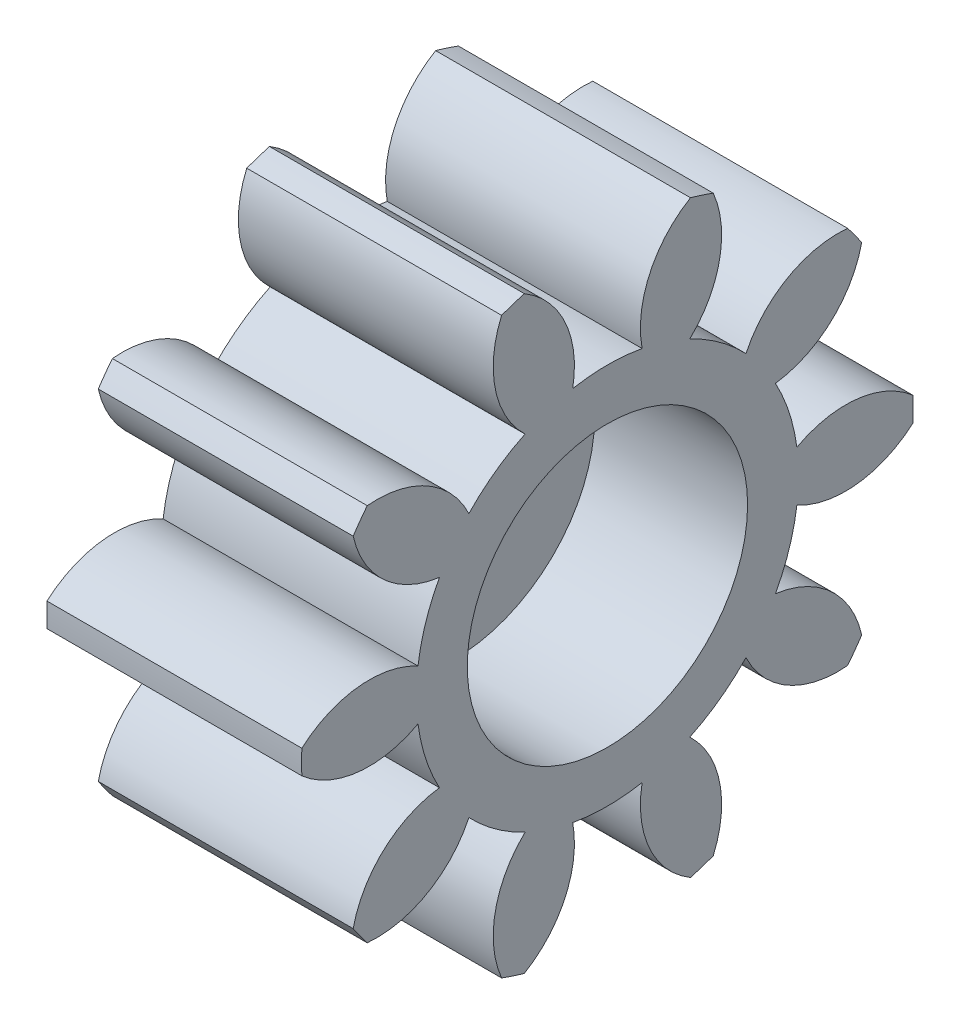
from build123d import *

# Parameters (mm, degrees)
BASPROSKE_W             = 5
BASPROSKE_H             = 6
TOOTHCUT_DEPTH          = 10.848857802
TEETHCUTS_COUNT         = 10
TEETHCUTS_ANGLE         = 324
BORSKE_R                = 1.5
BORE_DEPTH              = 50.0000508
ESQUISSE1_R             = 2.75
ENL_V_MAT_EXTRU_1_DEPTH = 3


with BuildPart() as part:
    # BasProSke → Base-Revolve (revolve)
    with BuildSketch(Plane(origin=(0, 0, 0), x_dir=(1, 0, 0), z_dir=(0, 1, 0)), mode=Mode.PRIVATE) as base_revolve_sk:
        with Locations((2.5, 3)):
            Rectangle(BASPROSKE_W, BASPROSKE_H)
    revolve(base_revolve_sk.sketch.rotate(Axis((-10, 0, 0), (1, 0, 0)), 180), axis=Axis((-10, 0, 0), (1, 0, 0)))

    # TooCutSke → ToothCut (cut, through all)
    with BuildSketch(Plane(origin=(0, 0, 0), x_dir=(0, 0, -1), z_dir=(1, 0, 0))):
        with BuildLine():
            ThreePointArc((0.680948119, 3.686639481), (0, 3.749), (-0.680948119, 3.686639481))
            ThreePointArc((-0.680948119, 3.686639481), (-0.833594699, 4.896067871), (-1.659981216, 5.7922282))
            ThreePointArc((-1.659981216, 5.7922282), (0, 6.0254), (1.659981216, 5.7922282))
            ThreePointArc((1.659981216, 5.7922282), (0.833594699, 4.896067871), (0.680948119, 3.686639481))
        make_face()
    toothcut = extrude(amount=TOOTHCUT_DEPTH, mode=Mode.SUBTRACT)

    # TeethCuts: ToothCut ×10 about axis
    teethcuts_axis = Axis((-10, 0, 0), (1, 0, 0))
    for i in range(1, TEETHCUTS_COUNT):
        add(toothcut.rotate(teethcuts_axis, i * TEETHCUTS_ANGLE / (TEETHCUTS_COUNT - 1)), mode=Mode.SUBTRACT)

    # BorSke → Bore (cut, symmetric)
    with BuildSketch(Plane(origin=(0, 0, 0), x_dir=(0, 0, -1), z_dir=(1, 0, 0))):
        with Locations(Location((0, 0, 0), (0, 0, 180))):
            Circle(BORSKE_R)
    extrude(amount=BORE_DEPTH, both=True, mode=Mode.SUBTRACT)

    # Esquisse1 → Enlèv. mat.-Extru.1 (cut)
    with BuildSketch(Plane(origin=(5, 0, 0), x_dir=(0, 0, -1), z_dir=(1, 0, 0))):
        Circle(ESQUISSE1_R)
    extrude(amount=-ENL_V_MAT_EXTRU_1_DEPTH, mode=Mode.SUBTRACT)


solid = part.part
